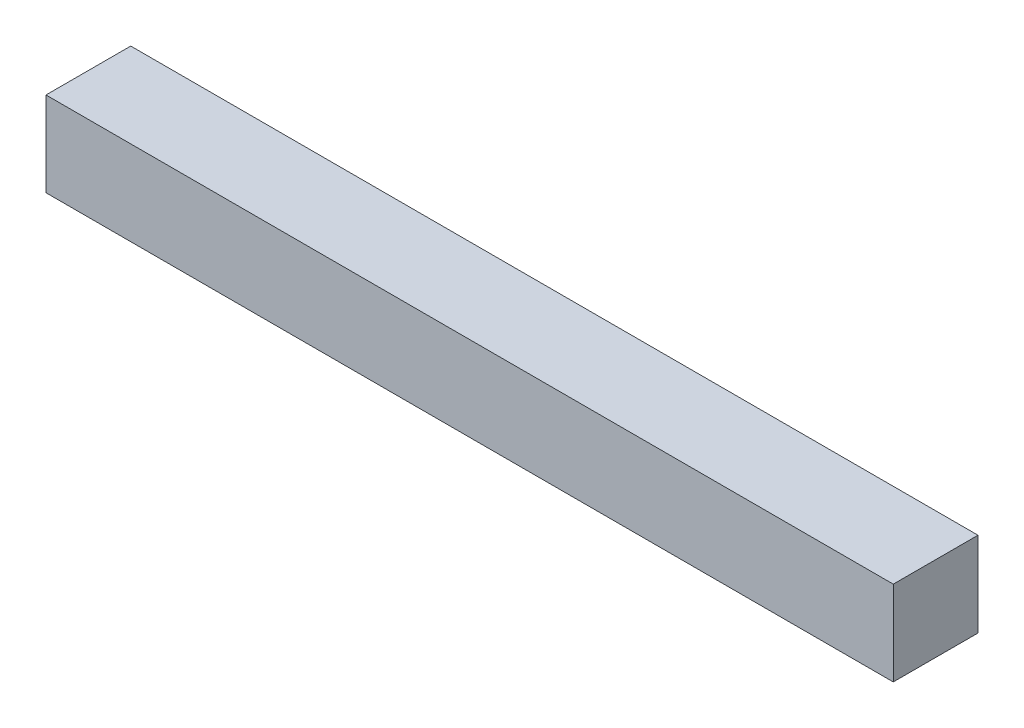
from build123d import *

# Parameters (mm, degrees)
SKETCH1_W           = 10
SKETCH1_H           = 10
BOSS_EXTRUDE1_DEPTH = 100


with BuildPart() as part:
    # Sketch1 → Boss-Extrude1 (new body)
    with BuildSketch(Plane(origin=(0, 0, 0), x_dir=(0, 0, -1), z_dir=(1, 0, 0))):
        Rectangle(SKETCH1_W, SKETCH1_H)
    extrude(amount=BOSS_EXTRUDE1_DEPTH)


solid = part.part
